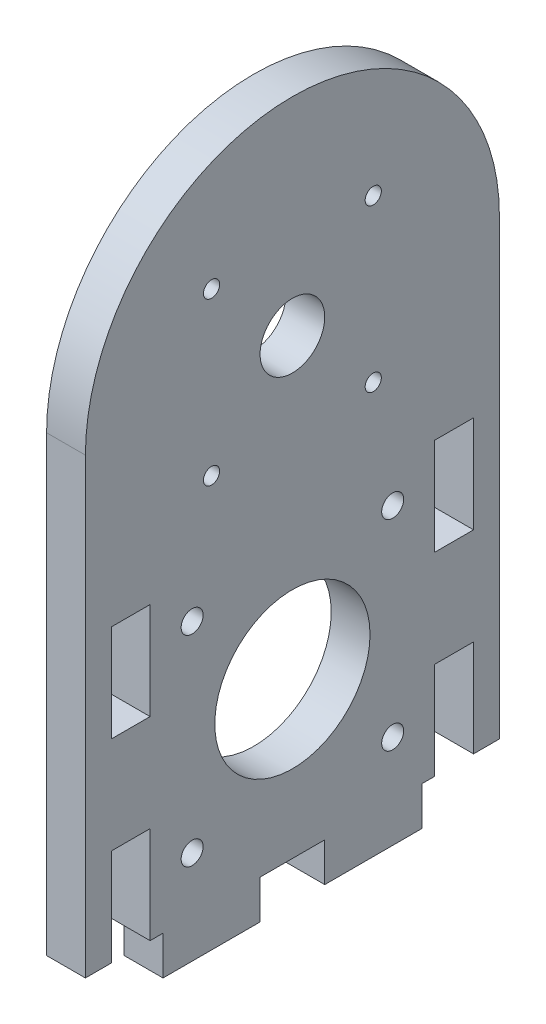
from build123d import *

# Parameters (mm, degrees)
CROQUIS1_R                   = 5
CROQUIS1_R_2                 = 12
SALIENTE_EXTRUIR1_DEPTH      = 3
TALADRO_DE_MARGEN_PARA_M32_D = 3.4
TALADRO_ROSCADO_M3X0_51_D    = 2.5
CROQUIS8_W                   = 6
CROQUIS8_H                   = 15
CORTAR_EXTRUIR1_DEPTH        = 75.491610266
CROQUIS9_W                   = 15
CROQUIS9_H                   = 6
SALIENTE_EXTRUIR3_DEPTH      = 6


with BuildPart() as part:
    # Croquis1 → Saliente-Extruir1 (new, symmetric)
    with BuildSketch(Plane(origin=(0, 0, 0), x_dir=(0, 0, -1), z_dir=(1, 0, 0))):
        with BuildLine():
            Line((-32, -35), (-32, 35))
            ThreePointArc((-32, 35), (0, 67), (32, 35))
            Line((32, 35), (32, -35))
            Line((32, -35), (-32, -35))
        make_face()
        with Locations((0, 35)):
            Circle(CROQUIS1_R, mode=Mode.SUBTRACT)
        with Locations((0, -11)):
            Circle(CROQUIS1_R_2, mode=Mode.SUBTRACT)
    extrude(amount=SALIENTE_EXTRUIR1_DEPTH, both=True)

    # Taladro de margen para M32 (through all)
    with Locations(Plane(origin=(3, 0, 0), x_dir=(0, 0, -1), z_dir=(1, 0, 0))):
        with Locations((-15.5, 4.5), (-15.5, -26.5), (15.5, -26.5), (15.5, 4.5)):
            Hole(TALADRO_DE_MARGEN_PARA_M32_D / 2)

    # Taladro roscado M3x0.51 (through all)
    with Locations(Plane.ZY.offset(3)):
        with Locations((-12.5, 22.5), (-12.5, 47.5), (12.5, 47.5), (12.5, 22.5)):
            Hole(TALADRO_ROSCADO_M3X0_51_D / 2)

    # Croquis8 → Cortar-Extruir1 (cut, through all)
    with BuildSketch(Plane(origin=(3, 0, 0), x_dir=(0, 0, -1), z_dir=(1, 0, 0))):
        with Locations((-25, 2.5)):
            Rectangle(CROQUIS8_W, CROQUIS8_H)
        with Locations((-25, -27.5)):
            Rectangle(CROQUIS8_W, CROQUIS8_H)
        with Locations((25, -27.5)):
            Rectangle(CROQUIS8_W, CROQUIS8_H)
        with Locations((25, 2.5)):
            Rectangle(CROQUIS8_W, CROQUIS8_H)
    extrude(amount=-CORTAR_EXTRUIR1_DEPTH, mode=Mode.SUBTRACT)

    # Croquis9 → Saliente-Extruir3 (add, through all)
    with BuildSketch(Plane(origin=(3, 0, 0), x_dir=(0, 0, -1), z_dir=(1, 0, 0))):
        with Locations((-12.5, -38)):
            Rectangle(CROQUIS9_W, CROQUIS9_H)
        with Locations((12.5, -38)):
            Rectangle(CROQUIS9_W, CROQUIS9_H)
    extrude(amount=-SALIENTE_EXTRUIR3_DEPTH)


solid = part.part
